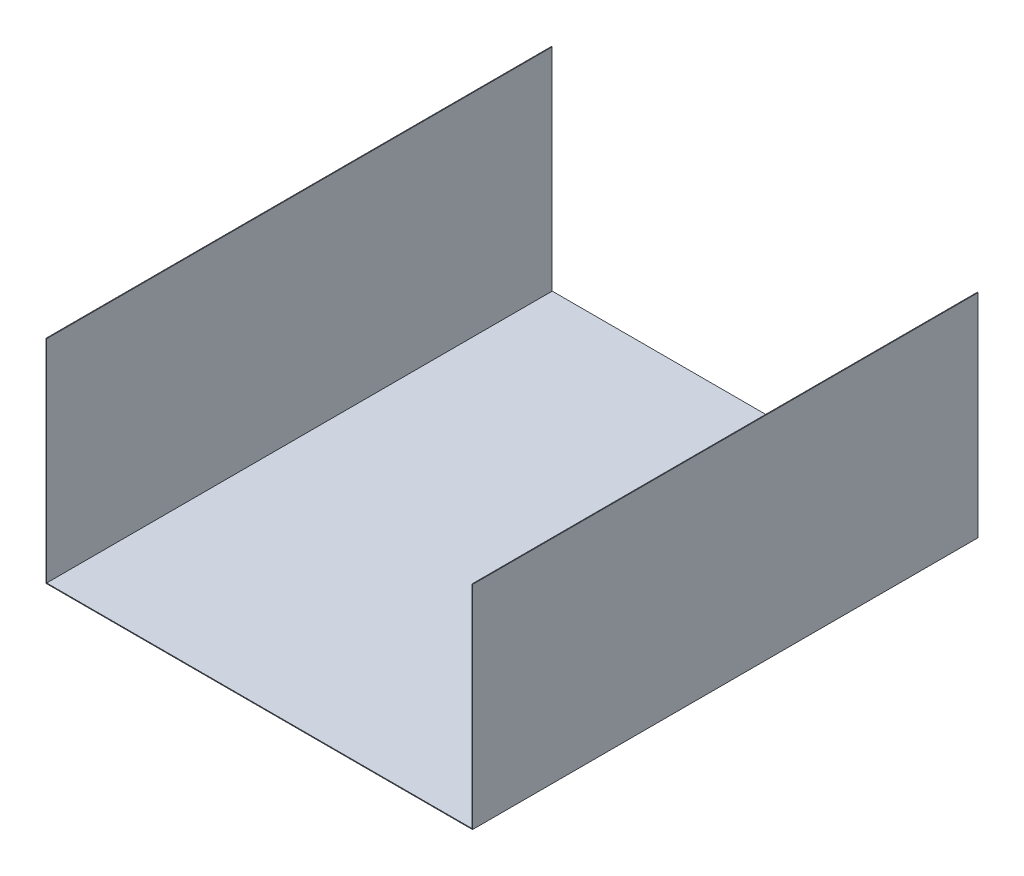
from build123d import *

# Parameters (mm, degrees)
CEK_1L_KUTU_U_1_0_1_DEPTH = 700


with BuildPart() as part:
    # Sketch1 → CEK_1L_kutu_U_1.0_1 (new body)
    with BuildSketch(Plane.XY):
        Polygon((13.7, 298), (13.7, 4), (604.3, 4), (604.3, 298), (603.3, 298), (603.3, 5), (14.7, 5), (14.7, 298), align=None)
    extrude(amount=-CEK_1L_KUTU_U_1_0_1_DEPTH)


solid = part.part
